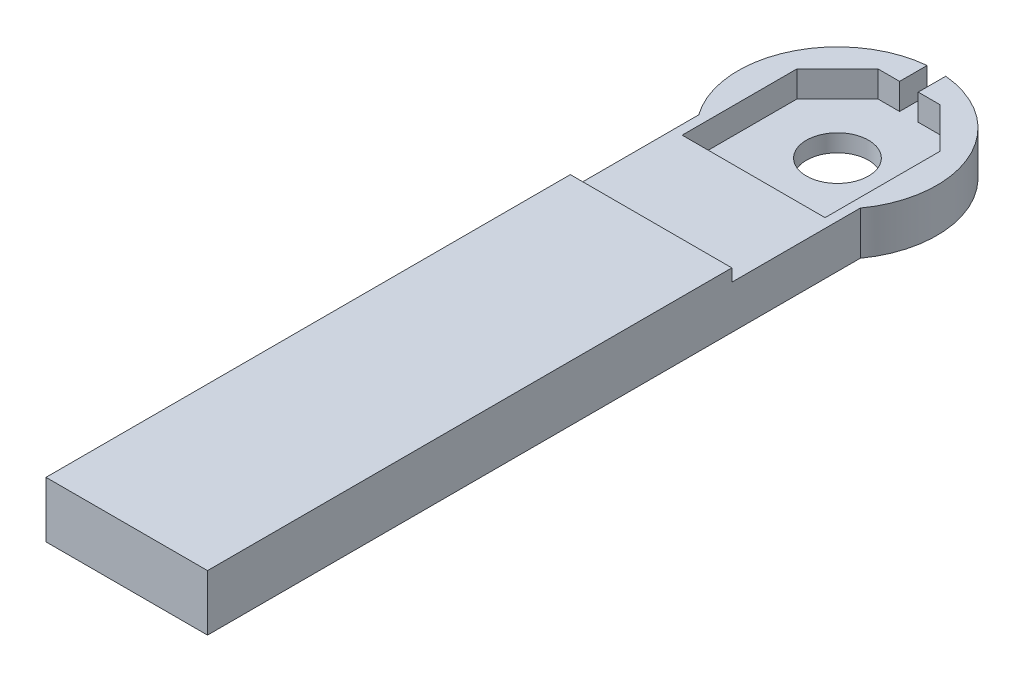
from build123d import *
from build123d.topology import SkipClean

# Parameters (mm, degrees)
BOSS_EXTRUDE1_DEPTH = 2.1
BOSS_EXTRUDE2_START = -1.4
SKETCH2_R           = 2.5
BOSS_EXTRUDE2_DEPTH = 1.4
SKETCH4_W           = 13
SKETCH4_H           = 4.5
BOSS_EXTRUDE3_DEPTH = 42.2


with BuildPart() as part:
    # Sketch1 → Boss-Extrude1 (new body)
    with BuildSketch(Plane(origin=(0, 0, 0), x_dir=(1, 0, 0), z_dir=(0, 1, 0))):
        with BuildLine():
            Line((-5.75, 2.5), (-2.5, 5.75))
            Line((-2.5, 5.75), (-0.75, 5.75))
            Line((-0.75, 5.75), (-0.75, 7.964766161))
            ThreePointArc((-0.75, 7.964766161), (-7.280803408, 3.31510207), (-6.5, -4.663689527))
            Line((-6.5, -4.663689527), (-6.5, -15))
            Line((-6.5, -15), (6.5, -15))
            Line((6.5, -15), (6.5, -4.663689527))
            ThreePointArc((6.5, -4.663689527), (7.280803408, 3.31510207), (0.75, 7.964766161))
            Line((0.75, 7.964766161), (0.75, 5.75))
            Line((0.75, 5.75), (2.5, 5.75))
            Line((2.5, 5.75), (5.75, 2.5))
            Line((5.75, 2.5), (5.75, -6.75))
            Line((5.75, -6.75), (-5.75, -6.75))
            Line((-5.75, -6.75), (-5.75, 2.5))
        make_face()
    extrude(amount=BOSS_EXTRUDE1_DEPTH)

    # Sketch2 → Boss-Extrude2 (add)
    with SkipClean():  # the faces are left unmerged after this step: merging them gives an invalid solid
        with BuildSketch(Plane(origin=(0, 0, 0), x_dir=(1, 0, 0), z_dir=(0, 1, 0)).offset(BOSS_EXTRUDE2_START)):
            with BuildLine():
                Line((6.5, -4.663689527), (6.5, -15))
                Line((6.5, -15), (-6.5, -15))
                Line((-6.5, -15), (-6.5, -4.663689527))
                ThreePointArc((-6.5, -4.663689527), (0, 8), (6.5, -4.663689527))
            make_face()
            with Locations(Location((0, 0, 0), (0, 0, 270))):
                Circle(SKETCH2_R, mode=Mode.SUBTRACT)
            with BuildLine():
                Line((-5, -5.5), (-5, -6.75))
                Line((-5, -6.75), (-3.5, -6.75))
                Line((-3.5, -6.75), (-3.5, -5.5))
                ThreePointArc((-3.5, -5.5), (-4.25, -4.75), (-5, -5.5))
            make_face(mode=Mode.SUBTRACT)
            with BuildLine():
                Line((3.5, -5.5), (3.5, -6.75))
                Line((3.5, -6.75), (5, -6.75))
                Line((5, -6.75), (5, -5.5))
                ThreePointArc((5, -5.5), (4.25, -4.75), (3.5, -5.5))
            make_face(mode=Mode.SUBTRACT)
        extrude(amount=BOSS_EXTRUDE2_DEPTH)

    # Sketch4 → Boss-Extrude3 (add)
    with SkipClean():  # the faces are left unmerged after this step: merging them gives an invalid solid
        with BuildSketch(Plane.XY.offset(15)):
            with Locations((0, 0.85)):
                Rectangle(SKETCH4_W, SKETCH4_H)
        extrude(amount=BOSS_EXTRUDE3_DEPTH)


solid = part.part
